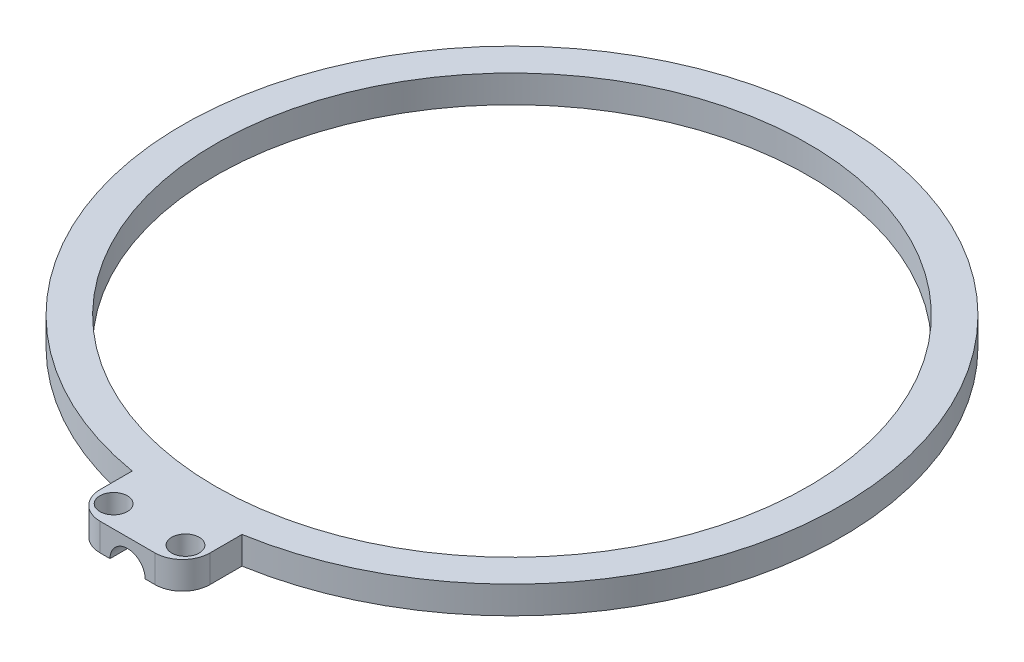
from build123d import *

# Parameters (mm, degrees)
SKETCH1_R                   = 76.2
SKETCH1_R_2                 = 68.58
BOSS_EXTRUDE1_DEPTH         = 3.175
BOSS_EXTRUDE2_DEPTH         = 6.35
FILLET1_R                   = 6.35
CUT_EXTRUDE1_DEPTH          = 11.43
F_3_8_0_25_DIAMETER_HOLE2_D = 6.35


with BuildPart() as part:
    # Sketch1 → Boss-Extrude1 (new, symmetric)
    with BuildSketch(Plane(origin=(0, 0, 0), x_dir=(1, 0, 0), z_dir=(0, 1, 0))):
        with Locations(Location((0, 0, 0), (0, 0, 270))):
            Circle(SKETCH1_R)
        with Locations(Location((0, 0, 0), (0, 0, 270))):
            Circle(SKETCH1_R_2, mode=Mode.SUBTRACT)
    extrude(amount=BOSS_EXTRUDE1_DEPTH, both=True)

    # Sketch2 → Boss-Extrude2 (add)
    with BuildSketch(Plane(origin=(0, 3.175, 0), x_dir=(1, 0, 0), z_dir=(0, 1, 0))):
        with BuildLine():
            Line((-12.7, -88.9), (-12.7, -75.134213245))
            ThreePointArc((-12.7, -75.134213245), (0, -76.2), (12.7, -75.134213245))
            Line((12.7, -75.134213245), (12.7, -88.9))
            Line((12.7, -88.9), (-12.7, -88.9))
        make_face()
    extrude(amount=-BOSS_EXTRUDE2_DEPTH)

    # Fillet1
    fillet1_edges = [part.edges().sort_by_distance(p)[0] for p in [
        (12.7, 0, 88.9),
        (-12.7, 0, 88.9),
    ]]
    fillet(fillet1_edges, radius=FILLET1_R)

    # Sketch3 → Cut-Extrude1 (cut)
    with BuildSketch(Plane.XY.offset(88.9)):
        with BuildLine():
            Line((-4.064, -3.175), (4.064, -3.175))
            ThreePointArc((4.064, -3.175), (0, 0.889), (-4.064, -3.175))
        make_face()
    extrude(amount=-CUT_EXTRUDE1_DEPTH, mode=Mode.SUBTRACT)

    # 3/8 (0.25) Diameter Hole2 (through all)
    with Locations(Plane(origin=(-8.3058, -3.175, 83.82), x_dir=(0, 0, -1), z_dir=(0, -1, 0))):
        with Locations((0, 0), (0, 16.6116)):
            Hole(F_3_8_0_25_DIAMETER_HOLE2_D / 2)


solid = part.part
